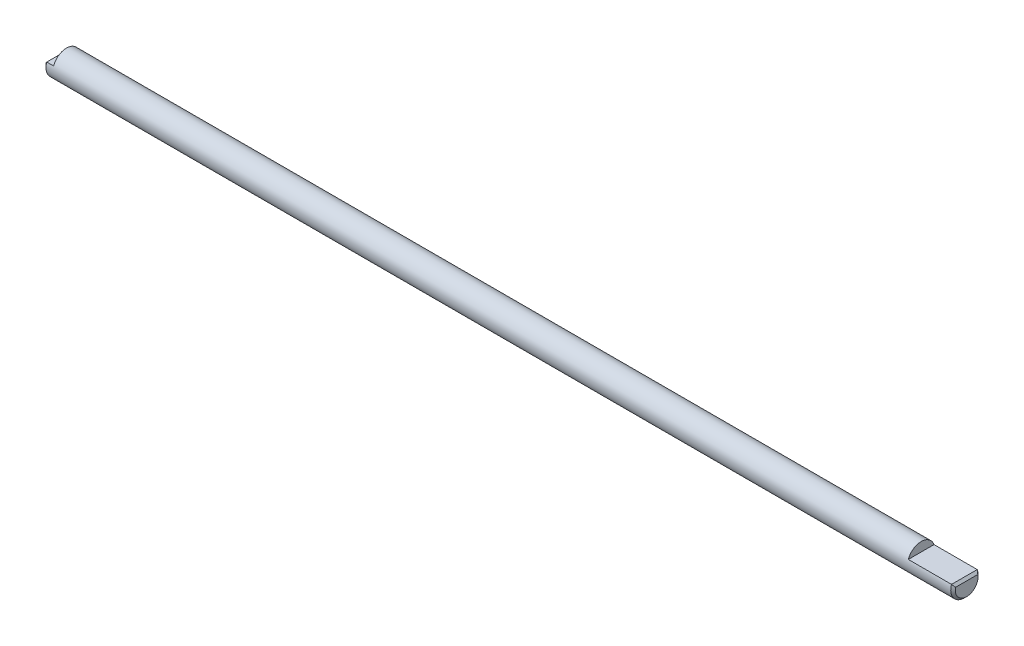
from build123d import *

# Parameters (mm, degrees)
SKETCH1_W               = 200
SKETCH1_H               = 3
CUT_EXTRUDE1_DEPTH      = 201.044994939
CUT_EXTRUDE1_DEPTH_BACK = 201.044994939
SKETCH2_W               = 2
SKETCH2_H               = 2
SKETCH2_W_2             = 10
CHAMFER1_SIZE           = 0.5


with BuildPart() as part:
    # Sketch1 → Revolve1 (revolve)
    with BuildSketch(Plane.XY, mode=Mode.PRIVATE) as revolve1_sk:
        with Locations((100, 1.5)):
            Rectangle(SKETCH1_W, SKETCH1_H)
    revolve(revolve1_sk.sketch.rotate(Axis((0, 0, 0), (1, 0, 0)), 90), axis=Axis((0, 0, 0), (1, 0, 0)))

    # Sketch2 → Cut-Extrude1 (cut, two sides: drawn at the far end of the back side and taken through both)
    with BuildSketch(Plane.XY.offset(-CUT_EXTRUDE1_DEPTH_BACK)):
        with Locations((1, 2)):
            Rectangle(SKETCH2_W, SKETCH2_H)
        with Locations((195, 2)):
            Rectangle(SKETCH2_W_2, SKETCH2_H)
    extrude(amount=CUT_EXTRUDE1_DEPTH + CUT_EXTRUDE1_DEPTH_BACK, mode=Mode.SUBTRACT)

    # Chamfer1
    chamfer1_edges = [part.edges().sort_by_distance(p)[0] for p in [
        (0, 1, 0),
        (200, -2.956795679, -0.507305936),
        (200, 1, 0),
        (0, -2.956795679, -0.507305936),
    ]]
    chamfer(chamfer1_edges, length=CHAMFER1_SIZE)


solid = part.part
